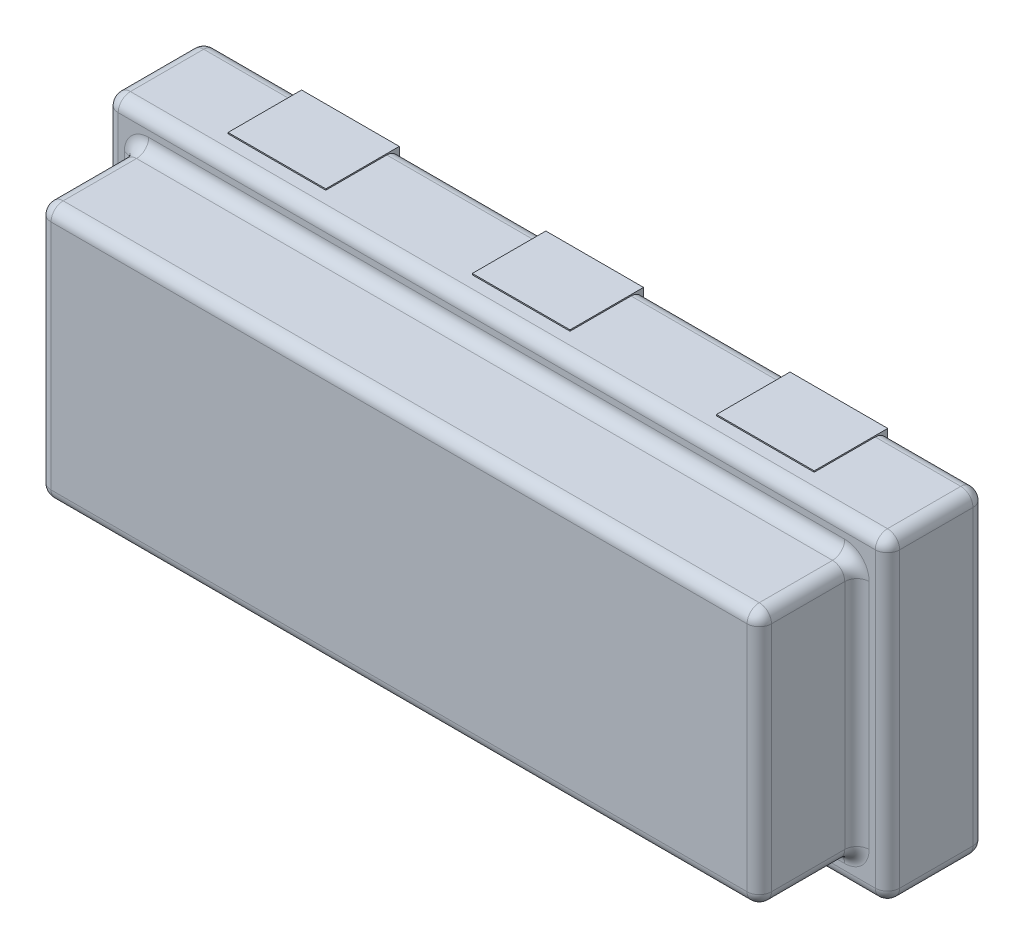
from build123d import *

# Parameters (mm, degrees)
SKETCH1_W                = 3.2
SKETCH1_H                = 1.3
BOSS_EXTRUDE1_DEPTH      = 0.4
SKETCH2_W                = 2.95
SKETCH2_H                = 1.05
BOSS_EXTRUDE2_DEPTH      = 0.4
FILLET1_R                = 0.05
BOSS_EXTRUDE3_DEPTH      = 0.001
BOSS_EXTRUDE3_DEPTH_BACK = 0.3
SKETCH3_W                = 0.4
SKETCH3_H                = 1.31


with BuildPart() as part:
    # Sketch1 → Boss-Extrude1 (new body)
    with BuildSketch(Plane.XY):
        Rectangle(SKETCH1_W, SKETCH1_H)
    extrude(amount=BOSS_EXTRUDE1_DEPTH)

    # Sketch2 → Boss-Extrude2 (add)
    with BuildSketch(Plane.XY.offset(0.4)):
        Rectangle(SKETCH2_W, SKETCH2_H)
    extrude(amount=BOSS_EXTRUDE2_DEPTH)

    # Fillet1
    fillet1_edges = [part.edges().sort_by_distance(p)[0] for p in [
        (1.6, 0, 0.4),
        (0, 0.65, 0.4),
        (-1.475, 0, 0.4),
        (-1.475, 0.525, 0.6),
        (0, -0.525, 0.4),
        (-1.475, -0.525, 0.6),
        (1.475, 0, 0.4),
        (1.475, -0.525, 0.6),
        (0, 0.525, 0.4),
        (1.475, 0.525, 0.6),
        (-1.475, 0, 0.8),
        (0, -0.525, 0.8),
        (1.475, 0, 0.8),
        (0, 0.525, 0.8),
        (-1.6, 0, 0.4),
        (0, 0.65, 0),
        (1.6, 0, 0),
        (0, -0.65, 0),
        (-1.6, 0, 0),
        (0, -0.65, 0.4),
        (-1.6, 0.65, 0.2),
        (1.6, 0.65, 0.2),
        (1.6, -0.65, 0.2),
        (-1.6, -0.65, 0.2),
    ]]
    fillet(fillet1_edges, radius=FILLET1_R)

    # Sketch3 → Boss-Extrude3 (add, two sides: drawn at the far end of the back side and taken through both)
    with BuildSketch(Plane(origin=(0, 0, 0), x_dir=(-1, 0, 0), z_dir=(0, 0, -1)).offset(-BOSS_EXTRUDE3_DEPTH_BACK)):
        with Locations((1, 0)):
            Rectangle(SKETCH3_W, SKETCH3_H)
        Rectangle(SKETCH3_W, SKETCH3_H)
        with Locations((-1, 0)):
            Rectangle(SKETCH3_W, SKETCH3_H)
    extrude(amount=BOSS_EXTRUDE3_DEPTH + BOSS_EXTRUDE3_DEPTH_BACK)


solid = part.part
